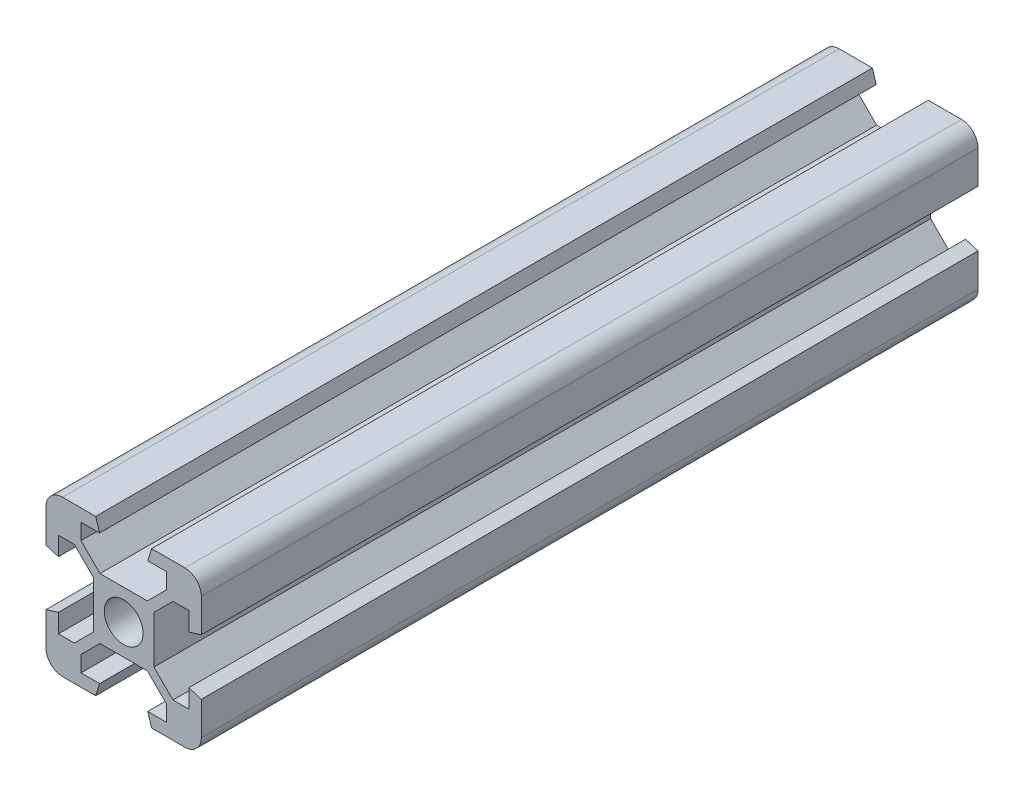
from build123d import *

# Parameters (mm, degrees)
SKETCH_1_R      = 2.5
EXTRUDE_1_DEPTH = 100


with BuildPart() as part:
    # 草图1 → 凸台-拉伸1 (new body)
    with BuildSketch(Plane.XY):
        with BuildLine():
            ThreePointArc((-7.878679656, 10), (-9.378679656, 9.378679656), (-10, 7.878679656))
            Line((-10, 7.878679656), (-10, 3.6))
            Line((-10, 3.6), (-8.4, 3.1))
            Line((-8.4, 3.1), (-8.4, 5.5))
            Line((-8.4, 5.5), (-6.348528137, 5.5))
            Line((-6.348528137, 5.5), (-3.9, 3.051471863))
            Line((-3.9, 3.051471863), (-3.9, -3.051471863))
            Line((-3.9, -3.051471863), (-6.348528137, -5.5))
            Line((-6.348528137, -5.5), (-8.4, -5.5))
            Line((-8.4, -5.5), (-8.4, -3.1))
            Line((-8.4, -3.1), (-10, -3.6))
            Line((-10, -3.6), (-10, -7.878679656))
            ThreePointArc((-10, -7.878679656), (-9.378679656, -9.378679656), (-7.878679656, -10))
            Line((-7.878679656, -10), (-3.6, -10))
            Line((-3.6, -10), (-3.1, -8.4))
            Line((-3.1, -8.4), (-5.5, -8.4))
            Line((-5.5, -8.4), (-5.5, -6.348528137))
            Line((-5.5, -6.348528137), (-3.051471863, -3.9))
            Line((-3.051471863, -3.9), (3.051471863, -3.9))
            Line((3.051471863, -3.9), (5.5, -6.348528137))
            Line((5.5, -6.348528137), (5.5, -8.4))
            Line((5.5, -8.4), (3.1, -8.4))
            Line((3.1, -8.4), (3.6, -10))
            Line((3.6, -10), (7.878679656, -10))
            ThreePointArc((7.878679656, -10), (9.378679656, -9.378679656), (10, -7.878679656))
            Line((10, -7.878679656), (10, -3.6))
            Line((10, -3.6), (8.4, -3.1))
            Line((8.4, -3.1), (8.4, -5.5))
            Line((8.4, -5.5), (6.348528137, -5.5))
            Line((6.348528137, -5.5), (3.9, -3.051471863))
            Line((3.9, -3.051471863), (3.9, 3.051471863))
            Line((3.9, 3.051471863), (6.348528137, 5.5))
            Line((6.348528137, 5.5), (8.4, 5.5))
            Line((8.4, 5.5), (8.4, 3.1))
            Line((8.4, 3.1), (10, 3.6))
            Line((10, 3.6), (10, 7.878679656))
            ThreePointArc((10, 7.878679656), (9.378679656, 9.378679656), (7.878679656, 10))
            Line((7.878679656, 10), (6.359631643, 10))
            Line((6.359631643, 10), (3.6, 10))
            Line((3.6, 10), (3.1, 8.4))
            Line((3.1, 8.4), (5.5, 8.4))
            Line((5.5, 8.4), (5.5, 6.348528137))
            Line((5.5, 6.348528137), (3.051471863, 3.9))
            Line((3.051471863, 3.9), (-3.051471863, 3.9))
            Line((-3.051471863, 3.9), (-5.5, 6.348528137))
            Line((-5.5, 6.348528137), (-5.5, 8.4))
            Line((-5.5, 8.4), (-3.1, 8.4))
            Line((-3.1, 8.4), (-3.6, 10))
            Line((-3.6, 10), (-6.359631643, 10))
            Line((-6.359631643, 10), (-7.878679656, 10))
        make_face()
        Circle(SKETCH_1_R, mode=Mode.SUBTRACT)
    extrude(amount=-EXTRUDE_1_DEPTH)


solid = part.part
